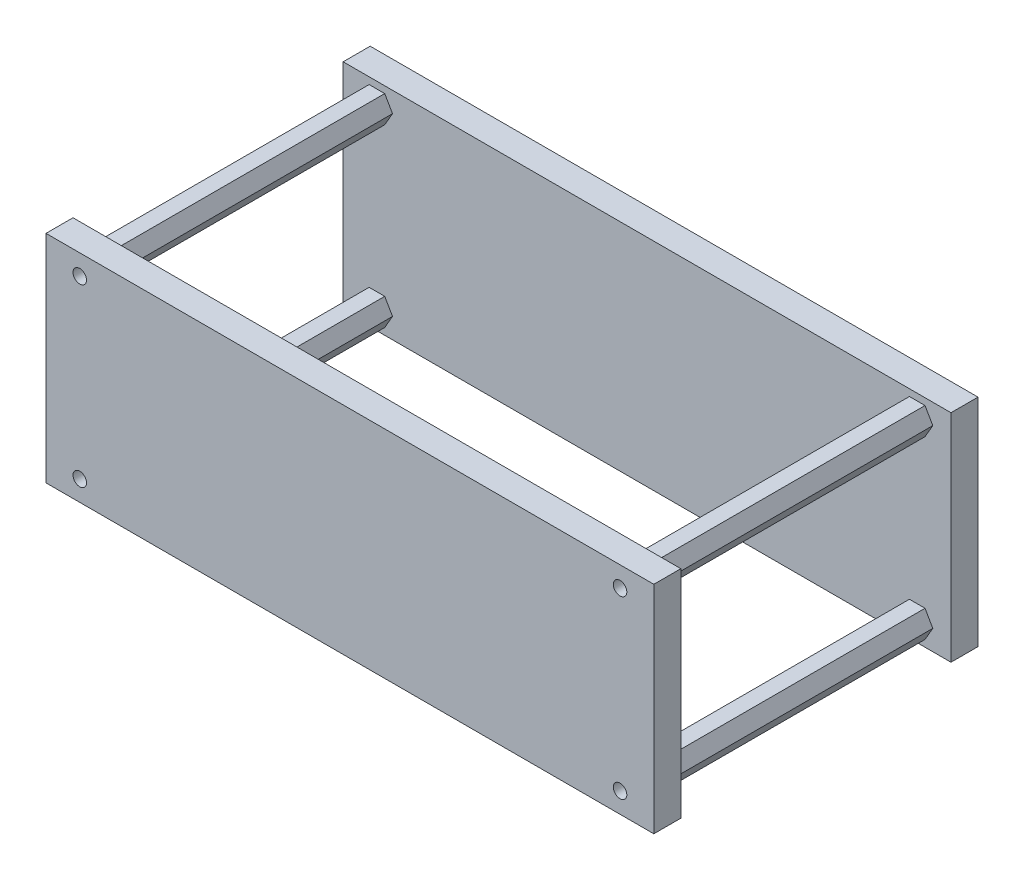
from build123d import *

# Parameters (mm, degrees)
SKETCH_1_W      = 45
SKETCH_1_H      = 16
SKETCH_1_R      = 0.5
EXTRUDE_1_DEPTH = 2
EXTRUDE_2_DEPTH = 20
SKETCH_3_W      = 45
SKETCH_3_H      = 16
SKETCH_3_R      = 0.5
EXTRUDE_3_DEPTH = 2


with BuildPart() as part:
    # 草图1 → 凸台-拉伸1 (new body)
    with BuildSketch(Plane.XY):
        Rectangle(SKETCH_1_W, SKETCH_1_H)
        with Locations((-20, -6.5)):
            Circle(SKETCH_1_R, mode=Mode.SUBTRACT)
        with Locations((-20, 6.5)):
            Circle(SKETCH_1_R, mode=Mode.SUBTRACT)
        with Locations((20, 6.5)):
            Circle(SKETCH_1_R, mode=Mode.SUBTRACT)
        with Locations((20, -6.5)):
            Circle(SKETCH_1_R, mode=Mode.SUBTRACT)
    extrude(amount=EXTRUDE_1_DEPTH)

    # 草图2 → 凸台-拉伸2 (add)
    with BuildSketch(Plane.XY.offset(2)):
        Polygon((-18.845299462, 6.5), (-19.422649731, 7.5), (-20.577350269, 7.5), (-21.154700538, 6.5), (-20.577350269, 5.5), (-19.422649731, 5.5), align=None)
        Polygon((19.422649731, 5.5), (18.845299462, 6.5), (19.422649731, 7.5), (20.577350269, 7.5), (21.154700538, 6.5), (20.577350269, 5.5), align=None)
        Polygon((18.845299462, -6.5), (19.422649731, -7.5), (20.577350269, -7.5), (21.154700538, -6.5), (20.577350269, -5.5), (19.422649731, -5.5), align=None)
        Polygon((-19.422649731, -5.5), (-18.845299462, -6.5), (-19.422649731, -7.5), (-20.577350269, -7.5), (-21.154700538, -6.5), (-20.577350269, -5.5), align=None)
    extrude(amount=EXTRUDE_2_DEPTH)

    # 草图3 → 凸台-拉伸3 (add)
    with BuildSketch(Plane.XY.offset(22)):
        Rectangle(SKETCH_3_W, SKETCH_3_H)
        with Locations(Location((20, 6.5, 0), (0, 0, 180))):
            Circle(SKETCH_3_R, mode=Mode.SUBTRACT)
        with Locations(Location((-20, -6.5, 0), (0, 0, 180))):
            Circle(SKETCH_3_R, mode=Mode.SUBTRACT)
        with Locations((-20, 6.5)):
            Circle(SKETCH_3_R, mode=Mode.SUBTRACT)
        with Locations((20, -6.5)):
            Circle(SKETCH_3_R, mode=Mode.SUBTRACT)
    extrude(amount=EXTRUDE_3_DEPTH)


solid = part.part
